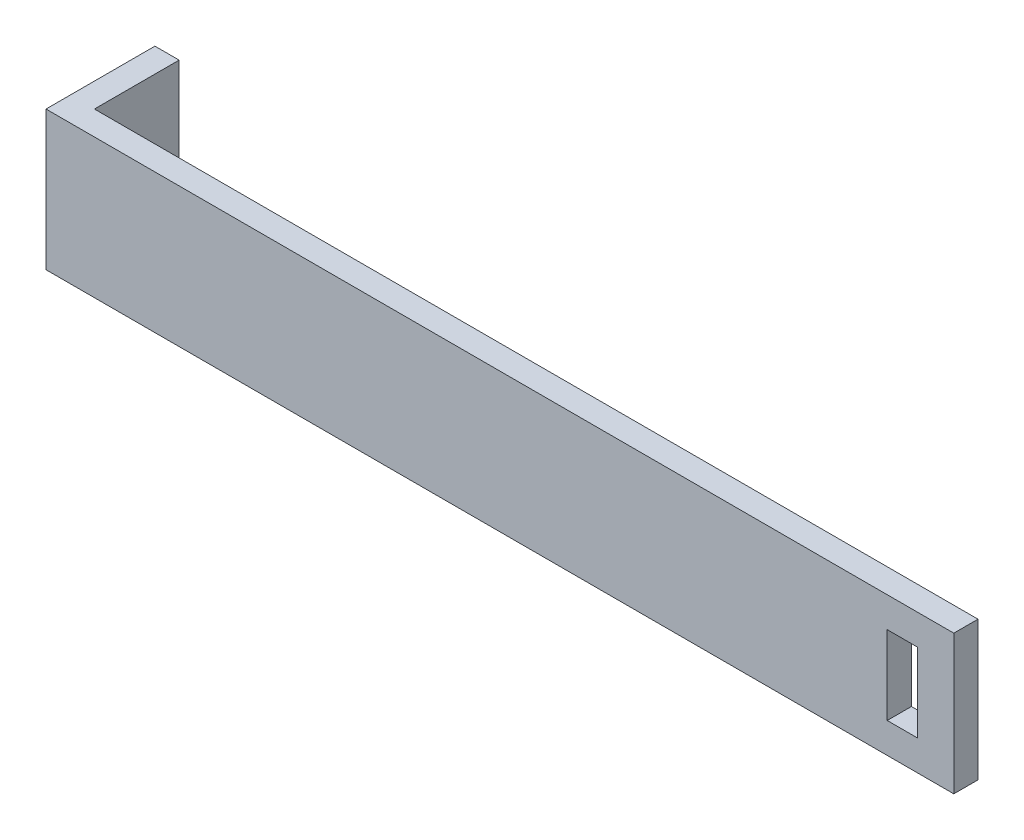
from build123d import *

# Parameters (mm, degrees)
SKETCH2_W           = 75
SKETCH2_H           = 11.5
BOSS_EXTRUDE1_DEPTH = 2
SKETCH3_W           = 2
SKETCH3_H           = 11.5
BOSS_EXTRUDE2_DEPTH = 7
SKETCH4_W           = 2.5
SKETCH4_H           = 6.5
CUT_EXTRUDE1_DEPTH  = 10


with BuildPart() as part:
    # Sketch2 → Boss-Extrude1 (new body)
    with BuildSketch(Plane.XY):
        with Locations((-52.326839827, 40.245670996)):
            Rectangle(SKETCH2_W, SKETCH2_H)
    extrude(amount=BOSS_EXTRUDE1_DEPTH)

    # Sketch3 → Boss-Extrude2 (add)
    with BuildSketch(Plane(origin=(0, 0, 0), x_dir=(-1, 0, 0), z_dir=(0, 0, -1))):
        with Locations((88.826839827, 40.245670996)):
            Rectangle(SKETCH3_W, SKETCH3_H)
    extrude(amount=BOSS_EXTRUDE2_DEPTH)

    # Sketch4 → Cut-Extrude1 (cut)
    with BuildSketch(Plane.XY.offset(2)):
        with Locations((-19.076839827, 40.245670996)):
            Rectangle(SKETCH4_W, SKETCH4_H)
    extrude(amount=-CUT_EXTRUDE1_DEPTH, mode=Mode.SUBTRACT)


solid = part.part
